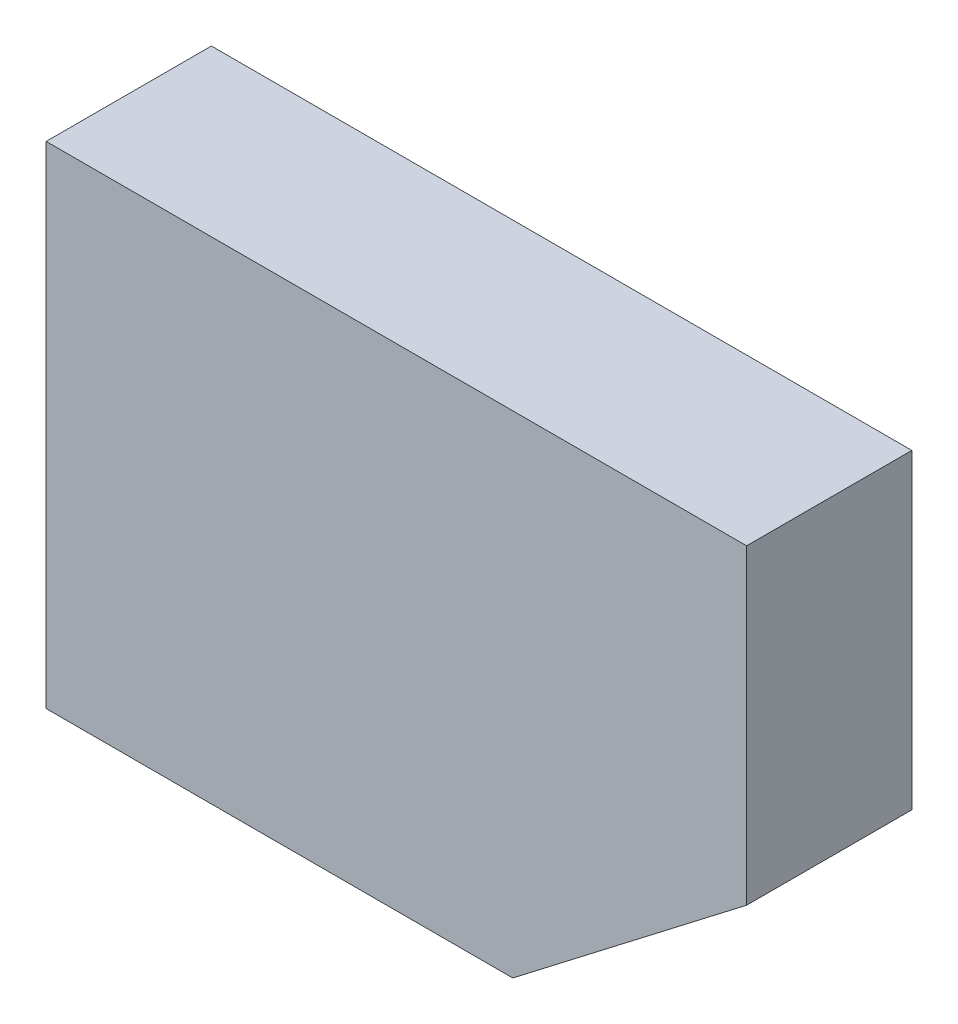
from build123d import *

# Parameters (mm, degrees)
EXTRUDE_1_DEPTH     = 8
SKETCH_2_W          = 25.296907813
SKETCH_2_H          = 21.985442263
SKETCH_2_W_2        = 19.585718922
SKETCH_2_H_2        = 21.456908972
CUT_EXTRUDE_1_DEPTH = 215.146433821


with BuildPart() as part:
    # Эскиз1 → Вытянуть1 (new body)
    with BuildSketch(Plane.XY):
        Polygon((-210.000000639, 0), (-210.000000639, -41.166671594), (-156.500000575, 0), align=None)
    extrude(amount=EXTRUDE_1_DEPTH)

    # Эскиз2 → Вырез-Вытянуть1 (cut, through all)
    with BuildSketch(Plane.XY.offset(8)):
        with Locations((-197.351546733, -34.775510048)):
            Rectangle(SKETCH_2_W, SKETCH_2_H)
        with Locations((-166.292859318, -6.126894901)):
            Rectangle(SKETCH_2_W_2, SKETCH_2_H_2)
    extrude(amount=-CUT_EXTRUDE_1_DEPTH, mode=Mode.SUBTRACT)


solid = part.part
